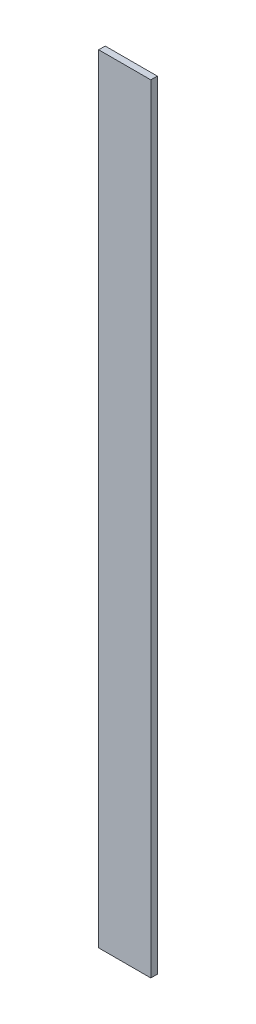
from build123d import *

# Parameters (mm, degrees)
DET2_ON_SOVE_DILIMI_1_START = 38.5
SKETCH1_W                   = 12
SKETCH1_H                   = 179
DET2_ON_SOVE_DILIMI_1_DEPTH = 1.5


with BuildPart() as part:
    # Sketch1 → DET2_on_sove_dilimi_1 (new body)
    with BuildSketch(Plane.XY.offset(DET2_ON_SOVE_DILIMI_1_START)):
        with Locations((708, 1558.5)):
            Rectangle(SKETCH1_W, SKETCH1_H)
    extrude(amount=DET2_ON_SOVE_DILIMI_1_DEPTH)


solid = part.part
